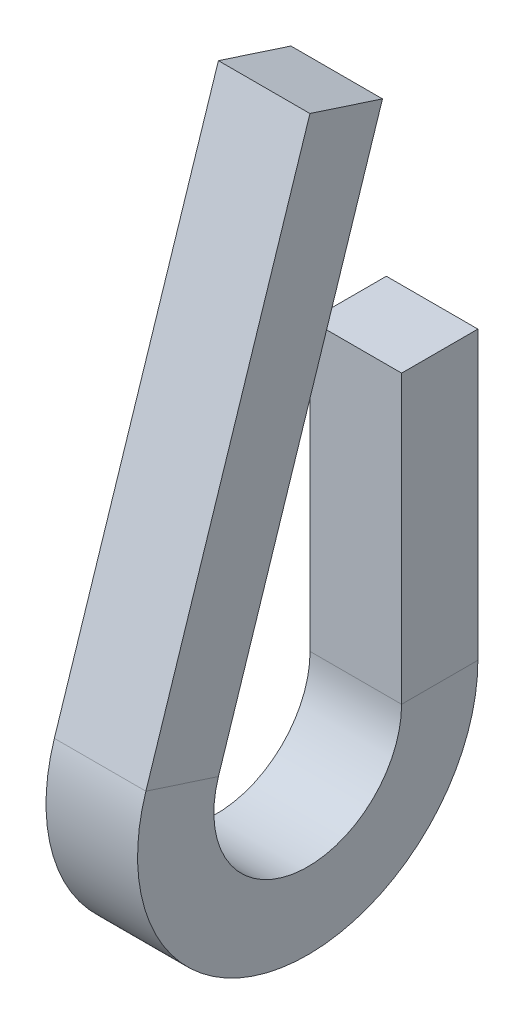
from build123d import *

# Parameters (mm, degrees)
ESQUISSE1_W = 12
ESQUISSE1_H = 10


with BuildPart() as part:
    # Balayage1: sweep along a path in Esquisse2
    with BuildLine(Plane(origin=(0, 0, 0), x_dir=(0, 0, -1), z_dir=(1, 0, 0))) as balayage1_path:
        Line((0, 0), (0, -37.597886471))
        ThreePointArc((0, -37.597886471), (-20.015041061, -54.69234646), (-33.767997639, -32.249561064))
        Line((-33.767997639, -32.249561064), (-12.263031239, 33.935919993))
    # Esquisse1 → Balayage1 (sweep)
    with BuildSketch(Plane(origin=(0, 0, 0), x_dir=(1, 0, 0), z_dir=(0, 1, 0))):
        Rectangle(ESQUISSE1_W, ESQUISSE1_H)
    sweep(path=balayage1_path.line)


solid = part.part
